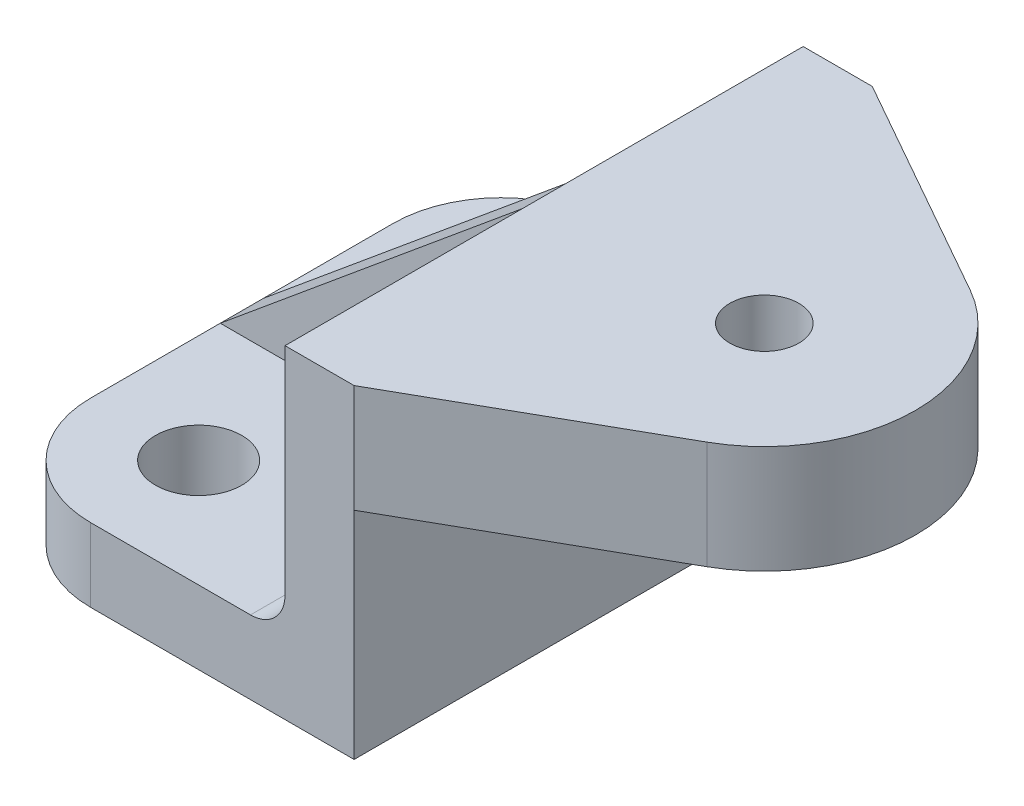
from build123d import *

# Parameters (mm, degrees)
SKETCH3_W           = 120
SKETCH3_H           = 17
BOSS_EXTRUDE1_DEPTH = 86
SKETCH5_W           = 120
SKETCH5_H           = 75
BOSS_EXTRUDE2_DEPTH = 16
BOSS_EXTRUDE3_DEPTH = 25
SKETCH11_R          = 8
CUT_EXTRUDE1_DEPTH  = 25
FILLET2_R           = 25
FILLET3_R           = 25
FILLET11_R          = 8
BOSS_EXTRUDE4_DEPTH = 65
CUT_EXTRUDE2_DEPTH  = 55
FILLET15_R          = 8
SKETCH16_R          = 10
CUT_EXTRUDE3_DEPTH  = 55
SKETCH17_R          = 10
CUT_EXTRUDE4_DEPTH  = 55


with BuildPart() as part:
    # Sketch3 → Boss-Extrude1 (new body)
    with BuildSketch(Plane(origin=(0, 0, 0), x_dir=(0, 0, -1), z_dir=(1, 0, 0))):
        with Locations((60, 8.5)):
            Rectangle(SKETCH3_W, SKETCH3_H)
    extrude(amount=BOSS_EXTRUDE1_DEPTH)

    # Sketch5 → Boss-Extrude2 (add)
    with BuildSketch(Plane(origin=(86, 0, 0), x_dir=(0, 0, -1), z_dir=(1, 0, 0))):
        with Locations((60, 37.5)):
            Rectangle(SKETCH5_W, SKETCH5_H)
    extrude(amount=-BOSS_EXTRUDE2_DEPTH)

    # Sketch7 → Boss-Extrude3 (add)
    with BuildSketch(Plane(origin=(0, 75, 0), x_dir=(1, 0, 0), z_dir=(0, 1, 0))):
        with BuildLine():
            Line((138.227979275, 90.466321244), (86, 120))
            Line((86, 120), (86, 60))
            Line((86, 60), (86, 0))
            Line((86, 0), (138.227979275, 29.533678756))
            ThreePointArc((138.227979275, 29.533678756), (156, 60), (138.227979275, 90.466321244))
        make_face()
    extrude(amount=-BOSS_EXTRUDE3_DEPTH)

    # Sketch11 → Cut-Extrude1 (cut)
    with BuildSketch(Plane(origin=(0, 75, 0), x_dir=(1, 0, 0), z_dir=(0, 1, 0))):
        with Locations(Location((121, 60, 0), (0, 0, 270))):
            Circle(SKETCH11_R)
    extrude(amount=-CUT_EXTRUDE1_DEPTH, mode=Mode.SUBTRACT)

    # Fillet2
    fillet2_edges = [part.edges().sort_by_distance(p)[0] for p in [
        (0, 8.5, 0),
    ]]
    fillet(fillet2_edges, radius=FILLET2_R)

    # Fillet3
    fillet3_edges = [part.edges().sort_by_distance(p)[0] for p in [
        (0, 8.5, -120),
    ]]
    fillet(fillet3_edges, radius=FILLET3_R)

    # Fillet11
    fillet11_edges = [part.edges().sort_by_distance(p)[0] for p in [
        (70, 17, -60),
    ]]
    fillet(fillet11_edges, radius=FILLET11_R)

    # Sketch14 → Boss-Extrude4 (add)
    with BuildSketch(Plane.XY):
        Polygon((70, 75), (0, 17), (70, 17), align=None)
    extrude(amount=-BOSS_EXTRUDE4_DEPTH)

    # Sketch15 → Cut-Extrude2 (cut)
    with BuildSketch(Plane.XY):
        Polygon((0, 17), (70, 75), (70, 17), align=None)
    extrude(amount=-CUT_EXTRUDE2_DEPTH, mode=Mode.SUBTRACT)

    # Fillet15
    fillet15_edges = [part.edges().sort_by_distance(p)[0] for p in [
        (70, 17, -27.5),
    ]]
    fillet(fillet15_edges, radius=FILLET15_R)

    # Sketch16 → Cut-Extrude3 (cut)
    with BuildSketch(Plane(origin=(0, 17, 0), x_dir=(1, 0, 0), z_dir=(0, 1, 0))):
        with Locations(Location((25, 95, 0), (0, 0, 270))):
            Circle(SKETCH16_R)
    extrude(amount=-CUT_EXTRUDE3_DEPTH, mode=Mode.SUBTRACT)

    # Sketch17 → Cut-Extrude4 (cut)
    with BuildSketch(Plane(origin=(0, 17, 0), x_dir=(1, 0, 0), z_dir=(0, 1, 0))):
        with Locations(Location((25, 25, 0), (0, 0, 180))):
            Circle(SKETCH17_R)
    extrude(amount=-CUT_EXTRUDE4_DEPTH, mode=Mode.SUBTRACT)


solid = part.part
